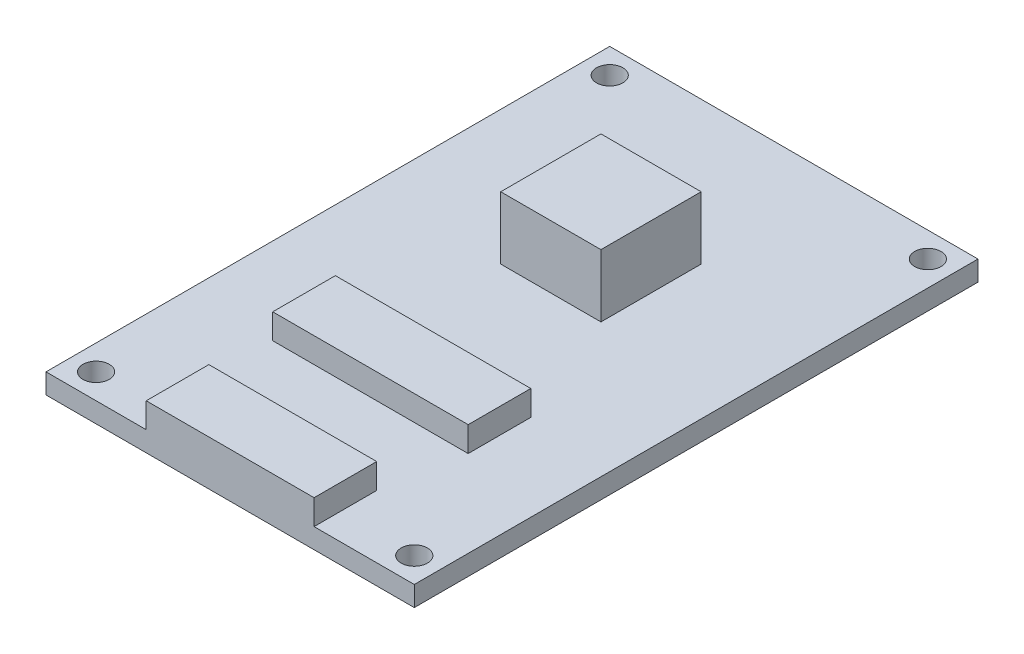
from build123d import *

# Parameters (mm, degrees)
SKETCH_2_W      = 29.4
SKETCH_2_H      = 45
SKETCH_2_R      = 1.05
EXTRUDE_1_DEPTH = 1.6
SKETCH_3_W      = 13.4
SKETCH_3_H      = 5
SKETCH_3_W_2    = 15.6
EXTRUDE_2_DEPTH = 2
SKETCH_4_W      = 14.7
SKETCH_4_H      = 4
EXTRUDE_3_DEPTH = 2
SKETCH_5_W      = 8
SKETCH_5_H      = 8
EXTRUDE_4_DEPTH = 5


with BuildPart() as part:
    # 草图2 → 凸台-拉伸1 (new body)
    with BuildSketch(Plane(origin=(0, 0, 0), x_dir=(1, 0, 0), z_dir=(0, 1, 0))):
        with Locations((14.7, 22.5)):
            Rectangle(SKETCH_2_W, SKETCH_2_H)
        with Locations(Location((2, 43, 0), (0, 0, 270))):
            Circle(SKETCH_2_R, mode=Mode.SUBTRACT)
        with Locations(Location((27.4, 43, 0), (0, 0, 270))):
            Circle(SKETCH_2_R, mode=Mode.SUBTRACT)
        with Locations(Location((2, 2, 0), (0, 0, 270))):
            Circle(SKETCH_2_R, mode=Mode.SUBTRACT)
        with Locations(Location((27.4, 2, 0), (0, 0, 270))):
            Circle(SKETCH_2_R, mode=Mode.SUBTRACT)
    extrude(amount=EXTRUDE_1_DEPTH)

    # 草图3 → 凸台-拉伸2 (add)
    with BuildSketch(Plane(origin=(0, 1.6, 0), x_dir=(1, 0, 0), z_dir=(0, 1, 0))):
        with Locations((14.7, 2.5)):
            Rectangle(SKETCH_3_W, SKETCH_3_H)
        with Locations((14.7, 13.7)):
            Rectangle(SKETCH_3_W_2, SKETCH_3_H)
    extrude(amount=EXTRUDE_2_DEPTH)

    # 草图4 → 凸台-拉伸3 (add)
    with BuildSketch(Plane.XZ):
        with Locations((14.75, -4.3)):
            Rectangle(SKETCH_4_W, SKETCH_4_H)
    extrude(amount=EXTRUDE_3_DEPTH)

    # 草图5 → 凸台-拉伸4 (add)
    with BuildSketch(Plane(origin=(0, 1.6, 0), x_dir=(1, 0, 0), z_dir=(0, 1, 0))):
        with Locations((14.7, 29.6)):
            Rectangle(SKETCH_5_W, SKETCH_5_H)
    extrude(amount=EXTRUDE_4_DEPTH)


solid = part.part
